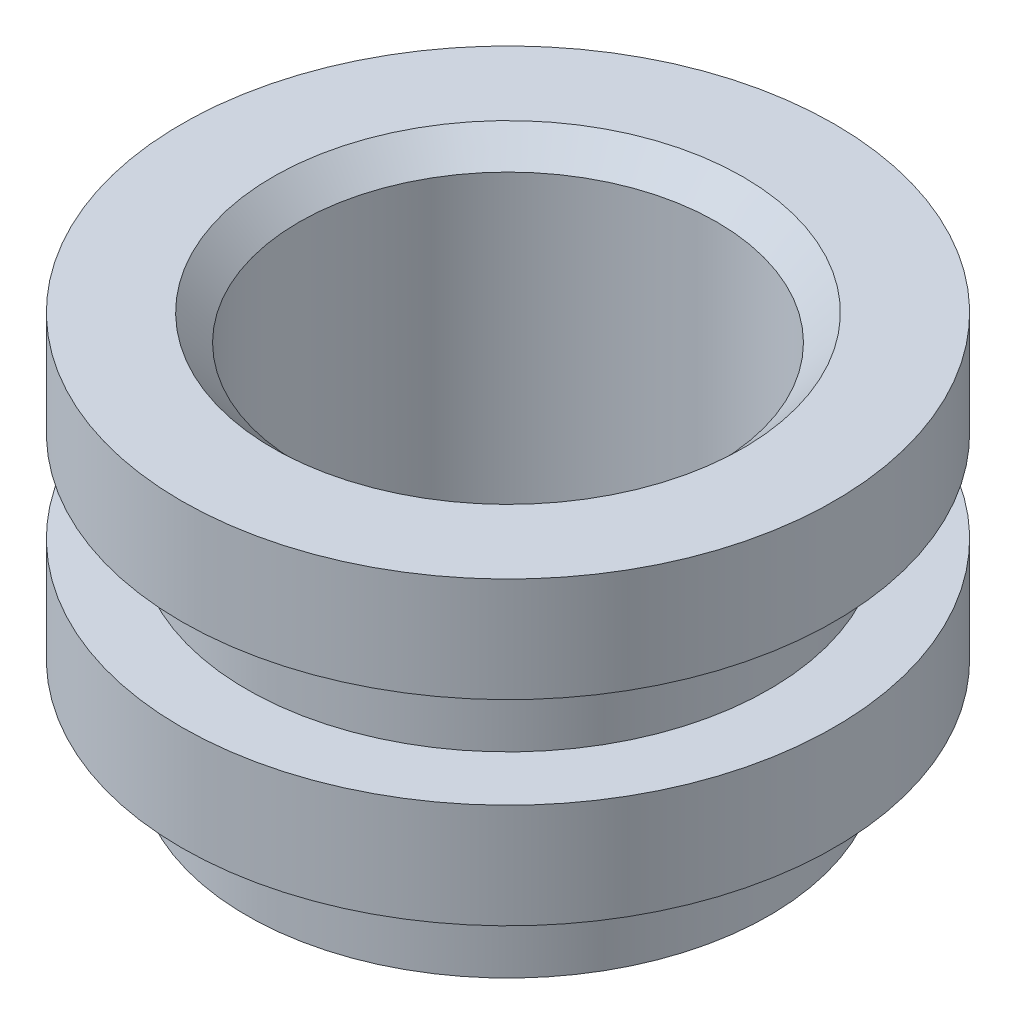
from build123d import *

# Parameters (mm, degrees)
CHAMFER_1_SIZE = 0.1


with BuildPart() as part:
    # 草图1 → 旋转1 (revolve)
    with BuildSketch(Plane.XY, mode=Mode.PRIVATE) as revolve_1_sk:
        Polygon((-0.8, 0.9584448), (-1.25, 0.9584448), (-1.25, 0.5584448), (-1, 0.5584448), (-1, 0.2084448), (-1.25, 0.2084448), (-1.25, -0.1915552), (-1, -0.1915552), (-1, -0.5415552), (-0.8, -0.5415552), align=None)
    revolve(revolve_1_sk.sketch.rotate(Axis((0, -2.604693141, 0), (0, 1, 0)), 270), axis=Axis((0, -2.604693141, 0), (0, 1, 0)))

    # 倒角1
    chamfer_1_edges = [part.edges().sort_by_distance(p)[0] for p in [
        (0, 0.9584448, 0.8),
        (0, -0.5415552, 0.8),
    ]]
    chamfer(chamfer_1_edges, length=CHAMFER_1_SIZE)


solid = part.part
